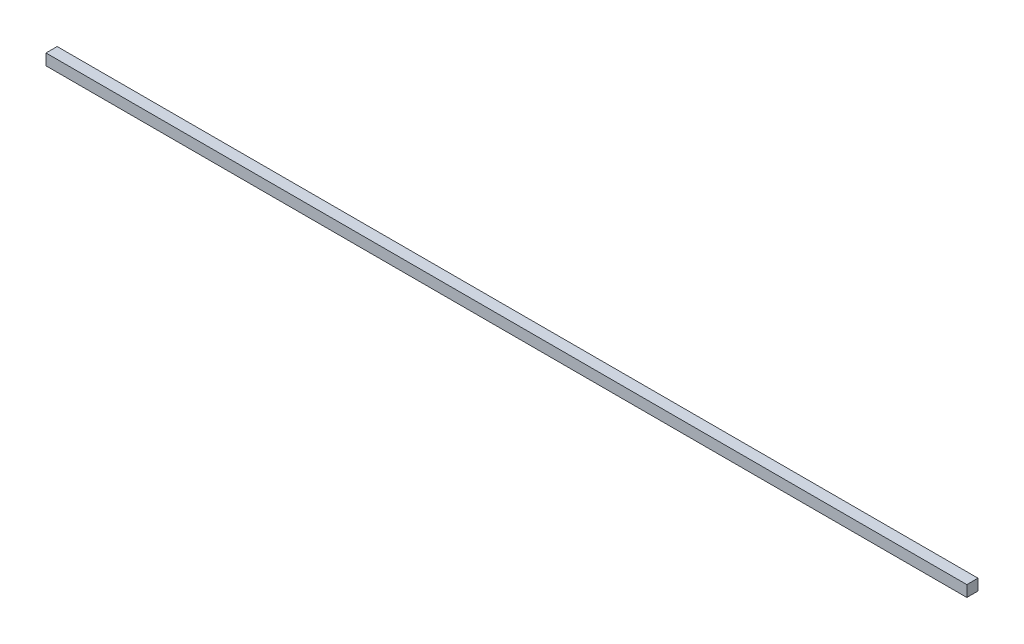
from build123d import *

# Parameters (mm, degrees)
TOPPING_KLAPE_KAT1_PIVOT_MIL_1_START = 22
SKETCH1_W                            = 660
SKETCH1_H                            = 8
TOPPING_KLAPE_KAT1_PIVOT_MIL_1_DEPTH = 8


with BuildPart() as part:
    # Sketch1 → TOPPING_klape_kat1_pivot_mil_1 (new body)
    with BuildSketch(Plane.XY.offset(TOPPING_KLAPE_KAT1_PIVOT_MIL_1_START)):
        with Locations((350, 1566)):
            Rectangle(SKETCH1_W, SKETCH1_H)
    extrude(amount=TOPPING_KLAPE_KAT1_PIVOT_MIL_1_DEPTH)


solid = part.part
